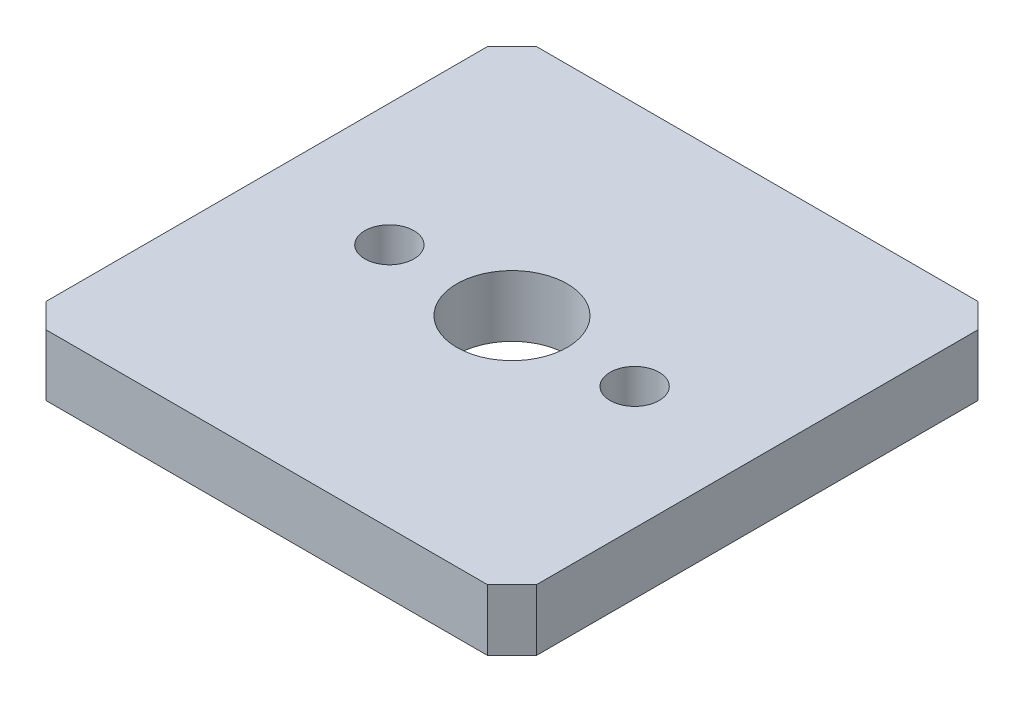
from build123d import *

# Parameters (mm, degrees)
SKETCH2_R           = 4.5
SKETCH2_R_2         = 2
BOSS_EXTRUDE1_DEPTH = 5


with BuildPart() as part:
    # Sketch2 → Boss-Extrude1 (new body)
    with BuildSketch(Plane(origin=(0, 0, 0), x_dir=(1, 0, 0), z_dir=(0, 1, 0))):
        Polygon((-20, 18), (-18, 20), (18, 20), (20, 18), (20, -18), (18, -20), (-18, -20), (-20, -18), align=None)
        with Locations(Location((0, 0, 0), (0, 0, 270))):
            Circle(SKETCH2_R, mode=Mode.SUBTRACT)
        with Locations(Location((10, 0, 0), (0, 0, 270))):
            Circle(SKETCH2_R_2, mode=Mode.SUBTRACT)
        with Locations(Location((-10, 0, 0), (0, 0, 270))):
            Circle(SKETCH2_R_2, mode=Mode.SUBTRACT)
    extrude(amount=BOSS_EXTRUDE1_DEPTH)


solid = part.part
